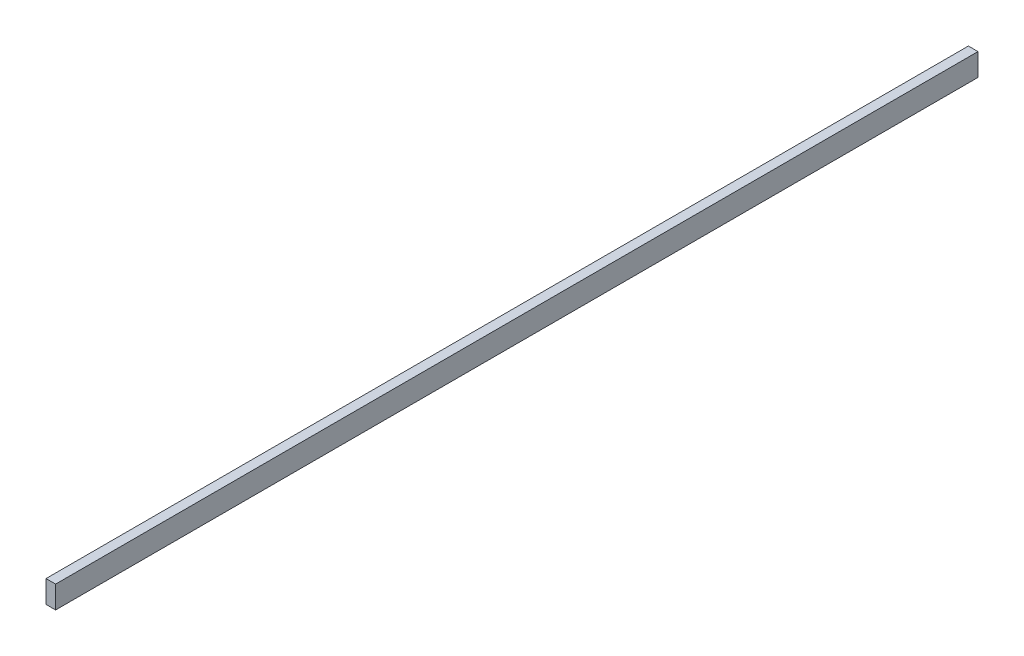
from build123d import *

# Parameters (mm, degrees)
SKETCH1_W      = 38.1
SKETCH1_H      = 88.9
EXTRUDE1_DEPTH = 1828.8


with BuildPart() as part:
    # Sketch1 → Extrude1 (new, symmetric)
    with BuildSketch(Plane.XY):
        Rectangle(SKETCH1_W, SKETCH1_H)
    extrude(amount=EXTRUDE1_DEPTH, both=True)


solid = part.part
